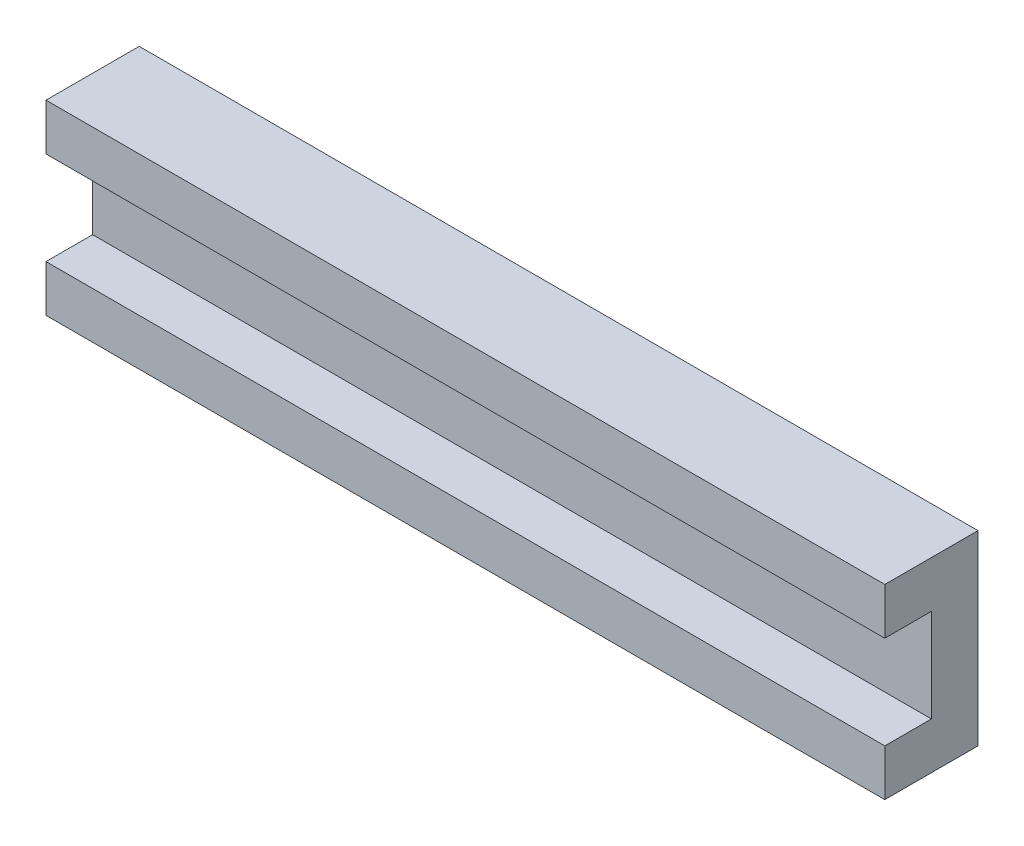
from build123d import *

# Parameters (mm, degrees)
BOSS_EXTRUDE1_DEPTH = 10
CUT_EXTRUDE2_DEPTH  = 22
BOSS_EXTRUDE2_DEPTH = 5


with BuildPart() as part:
    # Sketch1 → Boss-Extrude1 (new body)
    with BuildSketch(Plane.XY):
        Polygon((45, 0), (45, 10), (-45, 10), (-45, 0), (-45, -10), (45, -10), align=None)
    extrude(amount=BOSS_EXTRUDE1_DEPTH)

    # Sketch2 → Cut-Extrude2 (cut)
    with BuildSketch(Plane.XY):
        Polygon((0, 5), (45, 5), (45, -5), (0, -5), (-45, -5), (-45, 5), align=None)
    extrude(amount=CUT_EXTRUDE2_DEPTH, mode=Mode.SUBTRACT)


with BuildPart() as cut_extrude2_piece_1:
    # of the separate pieces the step leaves, piece 1, a body of its own (cut_extrude2_pieces)
    add(part.part.solids().sort_by_distance((45, -5, 0))[0])



with BuildPart() as cut_extrude2_piece_2:
    # of the separate pieces the step leaves, piece 2, a body of its own (cut_extrude2_pieces)
    add(part.part.solids().sort_by_distance((45, 10, 0))[0])


with BuildPart() as cut_extrude2_piece_1_1:
    add(cut_extrude2_piece_1.part)

    add(cut_extrude2_piece_2.part)  # Boss-Extrude2 merges Cut-Extrude2 piece 2
    # Sketch2<3> → Boss-Extrude2 (add)
    with BuildSketch(Plane.XY):
        Polygon((0, 5), (45, 5), (45, -5), (0, -5), (-45, -5), (-45, 5), align=None)
    extrude(amount=BOSS_EXTRUDE2_DEPTH)


solid = cut_extrude2_piece_1_1.part
